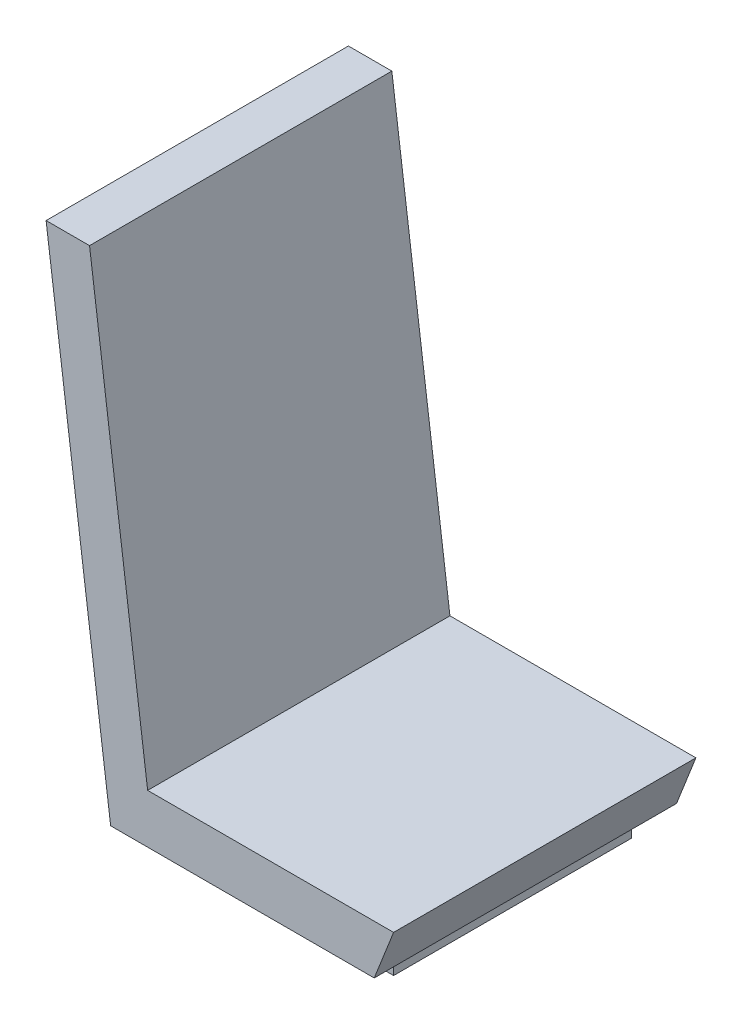
from build123d import *

# Parameters (mm, degrees)
SKETCH1_W                = 368.3
SKETCH1_H                = 31.75
BOSS_EXTRUDE1_DEPTH      = 368.3
SHELL1_T                 = -31.75
BOSS_EXTRUDE2_DEPTH      = 418.3
BOSS_EXTRUDE2_DEPTH_BACK = 50


with BuildPart() as part:
    # Sketch1 → Boss-Extrude1 (new body)
    with BuildSketch(Plane.XY):
        with Locations((184.15, 15.875)):
            Rectangle(SKETCH1_W, SKETCH1_H)
    extrude(amount=BOSS_EXTRUDE1_DEPTH)

    # Shell1
    shell1_openings = [part.faces().sort_by_distance(p)[0] for p in [
        (184.15, 31.75, 184.15),
        (184.15, 0, 184.15),
    ]]
    offset(amount=SHELL1_T, openings=shell1_openings, kind=Kind.INTERSECTION)

    # Sketch2 → Boss-Extrude2 (add, two sides: drawn at the far end of the back side and taken through both)
    with BuildSketch(Plane.XY.offset(-BOSS_EXTRUDE2_DEPTH_BACK)):
        Polygon((368.3, 31.75), (388.3, 31.75), (418.3, 107.95), (37.3, 107.95), (-52.7, 793.75), (-120, 793.75), (-20, 31.75), (0, 31.75), align=None)
    extrude(amount=BOSS_EXTRUDE2_DEPTH + BOSS_EXTRUDE2_DEPTH_BACK)


solid = part.part
